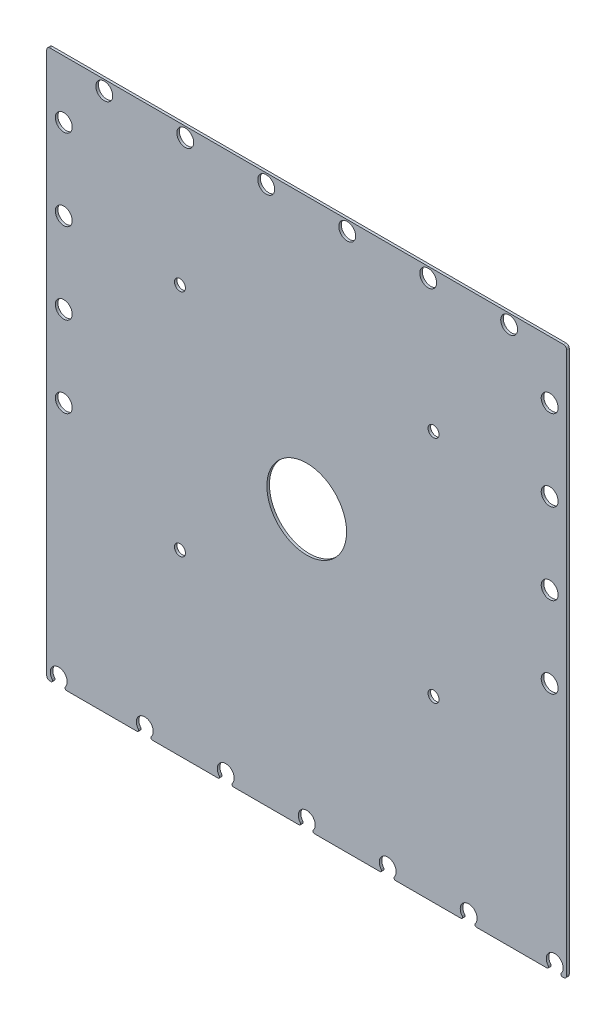
from build123d import *

# Parameters (mm, degrees)
SKETCH2_R               = 12.5
SKETCH2_R_2             = 2.65
BOSS_EXTRUDE2_DEPTH     = 0.8
FILLET1_R               = 1
CUT_EXTRUDE1_DEPTH      = 238.711107019
CUT_EXTRUDE1_DEPTH_BACK = 238.711107019
SKETCH5_R               = 1.725
FILLET2_R               = 0.5


with BuildPart() as part:
    # Sketch2 → Boss-Extrude2 (new body)
    with BuildSketch(Plane.XY):
        with BuildLine():
            Line((1, -171.98), (3.883580208, -171.98))
            ThreePointArc((3.883580208, -171.98), (4.7625, -166.83), (5.641419792, -171.98))
            Line((5.641419792, -171.98), (30.871080208, -171.98))
            ThreePointArc((30.871080208, -171.98), (31.75, -166.83), (32.628919792, -171.98))
            Line((32.628919792, -171.98), (56.271080208, -171.98))
            ThreePointArc((56.271080208, -171.98), (57.15, -166.83), (58.028919792, -171.98))
            Line((58.028919792, -171.98), (81.671080208, -171.98))
            ThreePointArc((81.671080208, -171.98), (82.55, -166.83), (83.428919792, -171.98))
            Line((83.428919792, -171.98), (107.071080208, -171.98))
            ThreePointArc((107.071080208, -171.98), (107.95, -166.83), (108.828919792, -171.98))
            Line((108.828919792, -171.98), (132.471080208, -171.98))
            ThreePointArc((132.471080208, -171.98), (133.35, -166.83), (134.228919792, -171.98))
            Line((134.228919792, -171.98), (159.458580208, -171.98))
            ThreePointArc((159.458580208, -171.98), (160.3375, -166.83), (161.216419792, -171.98))
            Line((161.216419792, -171.98), (164.1, -171.98))
            Line((164.1, -171.98), (164.1, 0))
            Line((164.1, 0), (1, 0))
            Line((1, 0), (1, -171.98))
        make_face()
        with Locations((82.55, -85)):
            Circle(SKETCH2_R, mode=Mode.SUBTRACT)
        with Locations((69.85, -3.175)):
            Circle(SKETCH2_R_2, mode=Mode.SUBTRACT)
        with Locations((6.35, -94.25)):
            Circle(SKETCH2_R_2, mode=Mode.SUBTRACT)
        with Locations((6.35, -68.85)):
            Circle(SKETCH2_R_2, mode=Mode.SUBTRACT)
        with Locations((6.35, -43.45)):
            Circle(SKETCH2_R_2, mode=Mode.SUBTRACT)
        with Locations((6.35, -18.05)):
            Circle(SKETCH2_R_2, mode=Mode.SUBTRACT)
        with Locations((19.05, -3.175)):
            Circle(SKETCH2_R_2, mode=Mode.SUBTRACT)
        with Locations((44.45, -3.175)):
            Circle(SKETCH2_R_2, mode=Mode.SUBTRACT)
        with Locations((146.05, -3.175)):
            Circle(SKETCH2_R_2, mode=Mode.SUBTRACT)
        with Locations((158.75, -18.05)):
            Circle(SKETCH2_R_2, mode=Mode.SUBTRACT)
        with Locations((158.75, -43.45)):
            Circle(SKETCH2_R_2, mode=Mode.SUBTRACT)
        with Locations((158.75, -94.25)):
            Circle(SKETCH2_R_2, mode=Mode.SUBTRACT)
        with Locations((158.75, -68.85)):
            Circle(SKETCH2_R_2, mode=Mode.SUBTRACT)
        with Locations((95.25, -3.175)):
            Circle(SKETCH2_R_2, mode=Mode.SUBTRACT)
        with Locations((120.65, -3.175)):
            Circle(SKETCH2_R_2, mode=Mode.SUBTRACT)
    extrude(amount=BOSS_EXTRUDE2_DEPTH)

    # Fillet1
    fillet1_edges = [part.edges().sort_by_distance(p)[0] for p in [
        (1, -171.98, 0.4),
        (1, 0, 0.4),
        (164.1, 0, 0.4),
        (164.1, -171.98, 0.4),
    ]]
    fillet(fillet1_edges, radius=FILLET1_R)

    # Sketch5 → Cut-Extrude1 (cut, two sides: drawn at the far end of the back side and taken through both)
    with BuildSketch(Plane.XY.offset(0.8).offset(-CUT_EXTRUDE1_DEPTH_BACK)):
        with Locations((42.775, -43.995)):
            Circle(SKETCH5_R)
        with Locations((122.325, -43.995)):
            Circle(SKETCH5_R)
        with Locations((122.325, -115.985)):
            Circle(SKETCH5_R)
        with Locations((42.775, -115.985)):
            Circle(SKETCH5_R)
    extrude(amount=CUT_EXTRUDE1_DEPTH + CUT_EXTRUDE1_DEPTH_BACK, mode=Mode.SUBTRACT)

    # Fillet2
    fillet2_edges = [part.edges().sort_by_distance(p)[0] for p in [
        (81.671080208, -171.98, 0.4),
        (58.028919792, -171.98, 0.4),
        (56.271080208, -171.98, 0.4),
        (32.628919792, -171.98, 0.4),
        (30.871080208, -171.98, 0.4),
        (5.641419792, -171.98, 0.4),
        (3.883580208, -171.98, 0.4),
        (161.216419792, -171.98, 0.4),
        (159.458580208, -171.98, 0.4),
        (134.228919792, -171.98, 0.4),
        (132.471080208, -171.98, 0.4),
        (108.828919792, -171.98, 0.4),
        (107.071080208, -171.98, 0.4),
        (83.428919792, -171.98, 0.4),
    ]]
    fillet(fillet2_edges, radius=FILLET2_R)


solid = part.part
